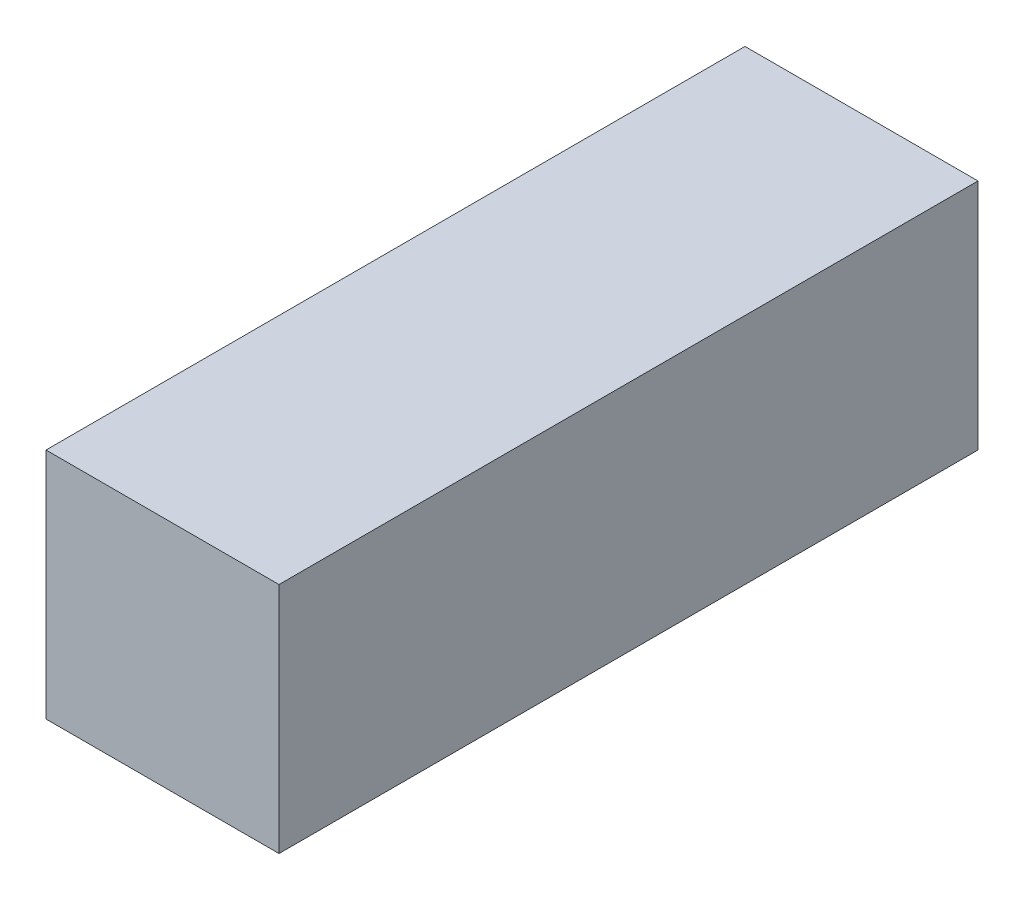
from build123d import *

# Parameters (mm, degrees)
SKETCH1_W           = 12.7
SKETCH1_H           = 12.7
BOSS_EXTRUDE1_DEPTH = 38.1


with BuildPart() as part:
    # Sketch1 → Boss-Extrude1 (new body)
    with BuildSketch(Plane.XY):
        Rectangle(SKETCH1_W, SKETCH1_H)
    extrude(amount=BOSS_EXTRUDE1_DEPTH)


solid = part.part
